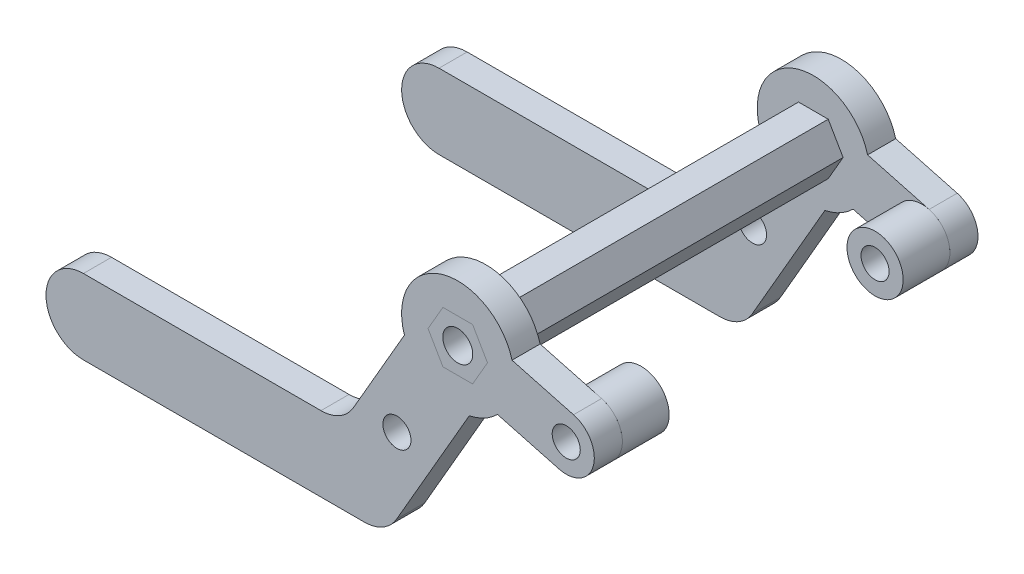
from build123d import *

# Parameters (mm, degrees)
SKETCH_1_R             = 1.5
EXTRUDE_1_DEPTH        = 1.5
PATTERN_LINEAR_1_COUNT = 2
PATTERN_LINEAR_1_PITCH = 38
SKETCH_2_R             = 1.6
EXTRUDE_2_DEPTH        = 41
SKETCH_4_R             = 3
SKETCH_4_R_2           = 1.5
EXTRUDE_3_DEPTH        = 5


with BuildPart() as part:
    # ｽｹｯﾁ1 → ﾎﾞｽ - 押し出し1 (new, symmetric)
    with BuildSketch(Plane.XY):
        with BuildLine():
            Line((-5.700169593, -1.872983346), (-11.154700538, -11.320508076))
            ThreePointArc((-11.154700538, -11.320508076), (-12.618802154, -12.784609691), (-14.618802154, -13.320508076))
            Line((-14.618802154, -13.320508076), (-40, -13.320508076))
            ThreePointArc((-40, -13.320508076), (-44, -17.320508076), (-40, -21.320508076))
            Line((-40, -21.320508076), (-10, -21.320508076))
            ThreePointArc((-10, -21.320508076), (-8, -20.784609691), (-6.535898385, -19.320508076))
            Line((-6.535898385, -19.320508076), (1.228033638, -5.872983346))
            ThreePointArc((1.228033638, -5.872983346), (2.854220329, -5.277634538), (4.242640687, -4.242640687))
            Line((4.242640687, -4.242640687), (10.81465278, -6.00360602))
            ThreePointArc((10.81465278, -6.00360602), (14.488887394, -3.882285677), (12.367567051, -0.208051062))
            Line((12.367567051, -0.208051062), (5.795554958, 1.552914271))
            ThreePointArc((5.795554958, 1.552914271), (-1.71361262, 5.75008972), (-5.700169593, -1.872983346))
        make_face()
        with Locations((11.591109915, -3.105828541)):
            Circle(SKETCH_1_R, mode=Mode.SUBTRACT)
        with Locations((-6.5, -11.258330249)):
            Circle(SKETCH_1_R, mode=Mode.SUBTRACT)
        Polygon((-1.58771324, -2.75), (1.58771324, -2.75), (3.175426481, 0), (1.58771324, 2.75), (-1.58771324, 2.75), (-3.175426481, 0), align=None, mode=Mode.SUBTRACT)
    extrude(amount=EXTRUDE_1_DEPTH, both=True)


with BuildPart() as pattern_linear_1_1:
    # 直線ﾊﾟﾀｰﾝ1: pattern copy
    add(part.part.moved(Location(Vector(0, 0, 1) * (1 * PATTERN_LINEAR_1_PITCH))))


with BuildPart() as body_3:
    # ｽｹｯﾁ2 → ﾎﾞｽ - 押し出し2 (new body)
    with BuildSketch(Plane.XY.offset(39.5)):
        Polygon((-1.58771324, -2.75), (1.58771324, -2.75), (3.175426481, 0), (1.58771324, 2.75), (-1.58771324, 2.75), (-3.175426481, 0), align=None)
        Circle(SKETCH_2_R, mode=Mode.SUBTRACT)
    extrude(amount=-EXTRUDE_2_DEPTH)


with BuildPart() as body_4:
    # ｽｹｯﾁ4 → ﾎﾞｽ - 押し出し3 (new body)
    with BuildSketch(Plane.XY.offset(1.5)):
        with Locations((11.591109915, -3.105828541)):
            Circle(SKETCH_4_R)
        with Locations((11.591109915, -3.105828541)):
            Circle(SKETCH_4_R_2, mode=Mode.SUBTRACT)
    extrude(amount=EXTRUDE_3_DEPTH)


with BuildPart() as body_5:
    # ﾐﾗｰ1: mirrored copy
    add(body_4.part.mirror(Plane(origin=(0, 0, 19), x_dir=(1, 0, 0), z_dir=(0, 0, -1))))


solid = Compound([part.part, pattern_linear_1_1.part, body_3.part, body_4.part, body_5.part])
